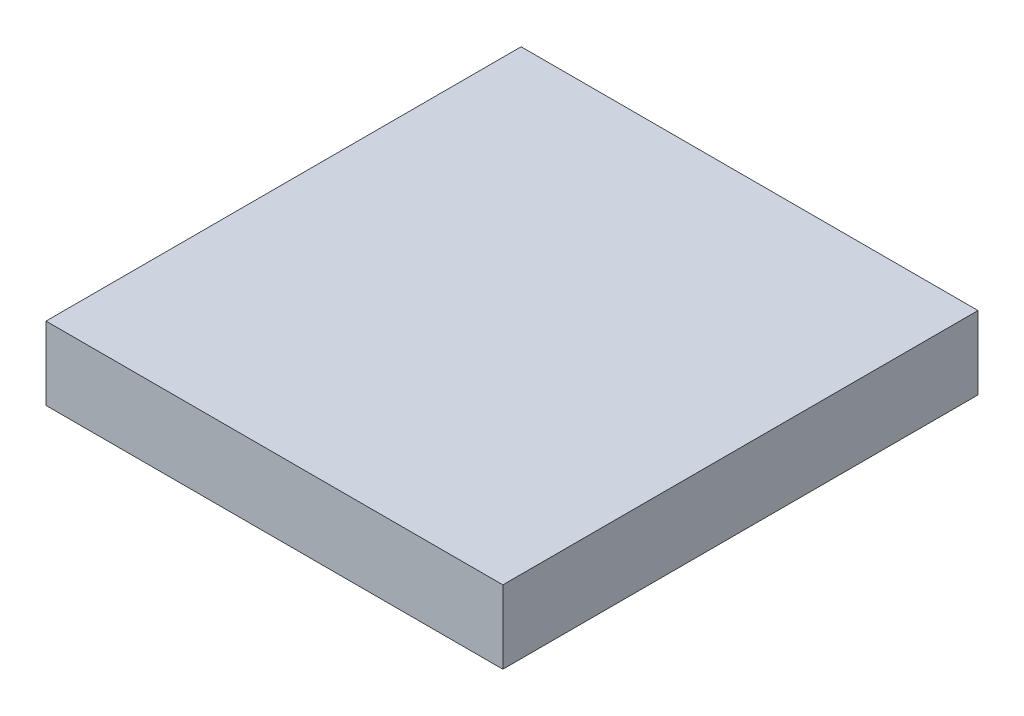
from build123d import *

# Parameters (mm, degrees)
SKETCH1_W           = 500
SKETCH1_H           = 520
BOSS_EXTRUDE1_DEPTH = 80


with BuildPart() as part:
    # Sketch1 → Boss-Extrude1 (new body)
    with BuildSketch(Plane(origin=(0, 0, 0), x_dir=(1, 0, 0), z_dir=(0, 1, 0))):
        with Locations((0, 260)):
            Rectangle(SKETCH1_W, SKETCH1_H)
    extrude(amount=-BOSS_EXTRUDE1_DEPTH)


solid = part.part
